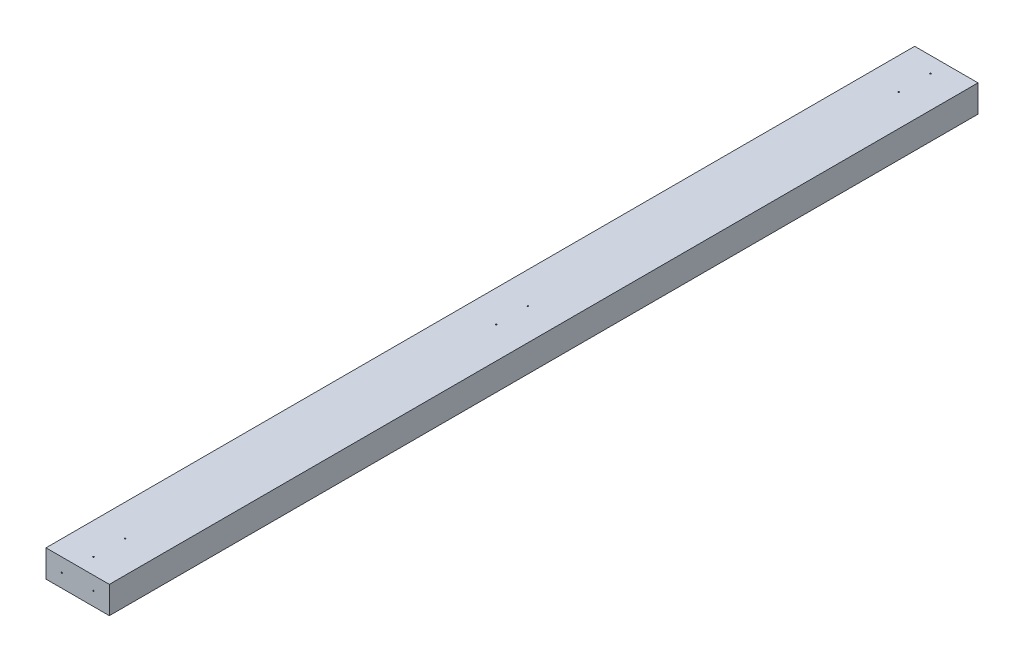
from build123d import *

# Parameters (mm, degrees)
SKETCH1_W           = 88.9
SKETCH1_H           = 38.1
BOSS_EXTRUDE1_DEPTH = 1219.2
SKETCH2_R           = 0.8763
CUT_EXTRUDE1_DEPTH  = 1219.2
SKETCH3_R           = 0.8763
CUT_EXTRUDE2_DEPTH  = 38.1


with BuildPart() as part:
    # Sketch1 → Boss-Extrude1 (new body)
    with BuildSketch(Plane.XY):
        with Locations((44.45, 19.05)):
            Rectangle(SKETCH1_W, SKETCH1_H)
    extrude(amount=BOSS_EXTRUDE1_DEPTH)

    # Sketch2 → Cut-Extrude1 (cut)
    with BuildSketch(Plane(origin=(0, 0, 0), x_dir=(-1, 0, 0), z_dir=(0, 0, -1))):
        with Locations((-66.675, 19.05)):
            Circle(SKETCH2_R)
        with Locations((-22.225, 19.05)):
            Circle(SKETCH2_R)
    extrude(amount=-CUT_EXTRUDE1_DEPTH, mode=Mode.SUBTRACT)

    # Sketch3 → Cut-Extrude2 (cut)
    with BuildSketch(Plane.XZ):
        with Locations(Location((44.45, 1196.975, 0), (0, 0, 270))):
            Circle(SKETCH3_R)
        with Locations(Location((44.45, 1152.525, 0), (0, 0, 270))):
            Circle(SKETCH3_R)
        with Locations(Location((44.45, 22.225, 0), (0, 0, 270))):
            Circle(SKETCH3_R)
        with Locations(Location((44.45, 66.675, 0), (0, 0, 270))):
            Circle(SKETCH3_R)
        with Locations(Location((44.45, 587.375, 0), (0, 0, 270))):
            Circle(SKETCH3_R)
        with Locations(Location((44.45, 631.825, 0), (0, 0, 270))):
            Circle(SKETCH3_R)
    extrude(amount=-CUT_EXTRUDE2_DEPTH, mode=Mode.SUBTRACT)


solid = part.part
